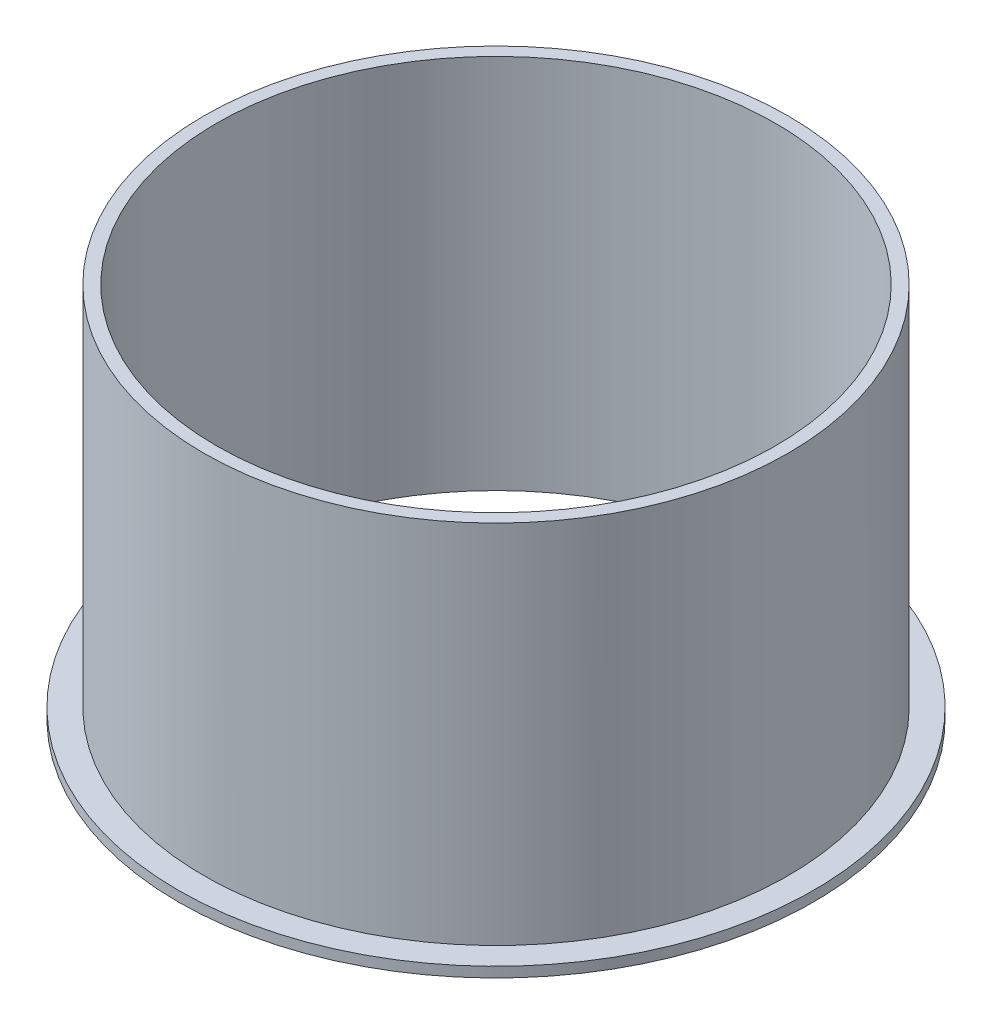
from build123d import *

# Parameters (mm, degrees)
SKETCH1_R           = 57.5
SKETCH1_R_2         = 55
BOSS_EXTRUDE1_DEPTH = 74
SKETCH2_R           = 62.5
SKETCH2_R_2         = 57.5
BOSS_EXTRUDE2_DEPTH = 2


with BuildPart() as part:
    # Sketch1 → Boss-Extrude1 (new body)
    with BuildSketch(Plane(origin=(0, 0, 0), x_dir=(1, 0, 0), z_dir=(0, 1, 0))):
        with Locations(Location((0, 0, 0), (0, 0, 270))):
            Circle(SKETCH1_R)
        with Locations(Location((0, 0, 0), (0, 0, 270))):
            Circle(SKETCH1_R_2, mode=Mode.SUBTRACT)
    extrude(amount=BOSS_EXTRUDE1_DEPTH)

    # Sketch2 → Boss-Extrude2 (add)
    with BuildSketch(Plane(origin=(0, 0, 0), x_dir=(-1, 0, 0), z_dir=(0, -1, 0))):
        with Locations(Location((0, 0, 0), (0, 0, 90))):
            Circle(SKETCH2_R)
        with Locations(Location((0, 0, 0), (0, 0, 90))):
            Circle(SKETCH2_R_2, mode=Mode.SUBTRACT)
    extrude(amount=-BOSS_EXTRUDE2_DEPTH)


solid = part.part
